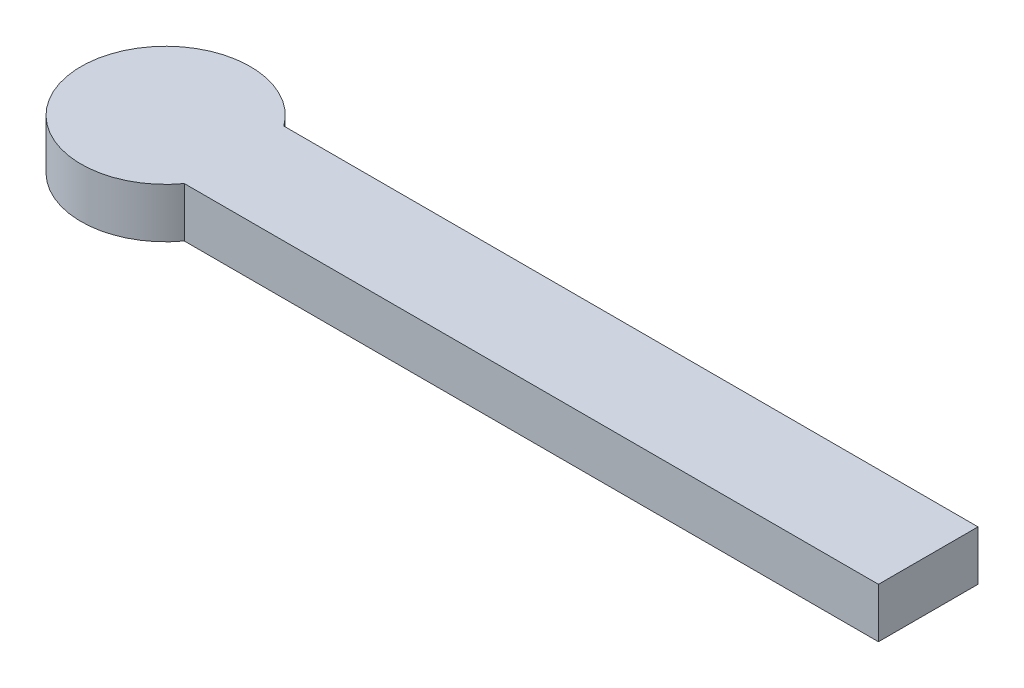
from build123d import *

# Parameters (mm, degrees)
ESQUISSE4_W        = 80
ESQUISSE4_H        = 10
BOSS_EXTRU_3_DEPTH = 5
ESQUISSE5_R        = 8.5
BOSS_EXTRU_5_DEPTH = 5


with BuildPart() as part:
    # Esquisse4 → Boss.-Extru.3 (new body)
    with BuildSketch(Plane(origin=(0, 0, 0), x_dir=(1, 0, 0), z_dir=(0, 1, 0))):
        Rectangle(ESQUISSE4_W, ESQUISSE4_H)
    extrude(amount=BOSS_EXTRU_3_DEPTH)

    # Esquisse5 → Boss.-Extru.5 (add)
    with BuildSketch(Plane(origin=(0, 5, 0), x_dir=(1, 0, 0), z_dir=(0, 1, 0))):
        with Locations((-36.607266223, 0)):
            Circle(ESQUISSE5_R)
    extrude(amount=-BOSS_EXTRU_5_DEPTH)


solid = part.part
